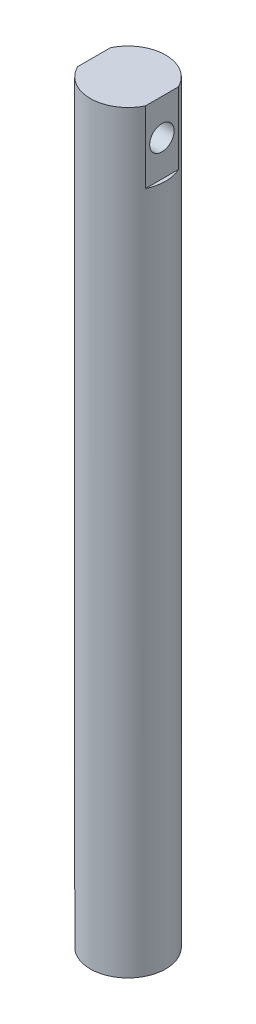
from build123d import *

# Parameters (mm, degrees)
SKETCH_1_R          = 10
EXTRUDE_1_DEPTH     = 200
CUT_EXTRUDE_START   = -19
CUT_EXTRUDE_1_DEPTH = 19
SKETCH_3_R          = 3.25
CUT_EXTRUDE_4_DEPTH = 202.149198358


with BuildPart() as part:
    # 草图1 → 凸台-拉伸1 (new body)
    with BuildSketch(Plane(origin=(0, 0, 0), x_dir=(1, 0, 0), z_dir=(0, 1, 0))):
        with Locations(Location((0, 0, 0), (0, 0, 270))):
            Circle(SKETCH_1_R)
    extrude(amount=EXTRUDE_1_DEPTH)

    # 草图2 → 切除-拉伸1 (cut)
    with BuildSketch(Plane(origin=(0, 200, 0), x_dir=(1, 0, 0), z_dir=(0, 1, 0)).offset(CUT_EXTRUDE_START)):
        with BuildLine():
            Line((-9, -4.358898944), (-9, 4.358898944))
            ThreePointArc((-9, 4.358898944), (-10, 0), (-9, -4.358898944))
        make_face()
        with BuildLine():
            ThreePointArc((10, 0), (9.746794345, 2.236067977), (9, 4.358898944))
            Line((9, 4.358898944), (9, -4.358898944))
            ThreePointArc((9, -4.358898944), (9.746794345, -2.236067977), (10, 0))
        make_face()
    extrude(amount=CUT_EXTRUDE_1_DEPTH, mode=Mode.SUBTRACT)

    # 草图3 → 切除-拉伸4 (cut, through all)
    with BuildSketch(Plane.ZY.offset(9)):
        with Locations((0, 190.5)):
            Circle(SKETCH_3_R)
    extrude(amount=-CUT_EXTRUDE_4_DEPTH, mode=Mode.SUBTRACT)


solid = part.part
